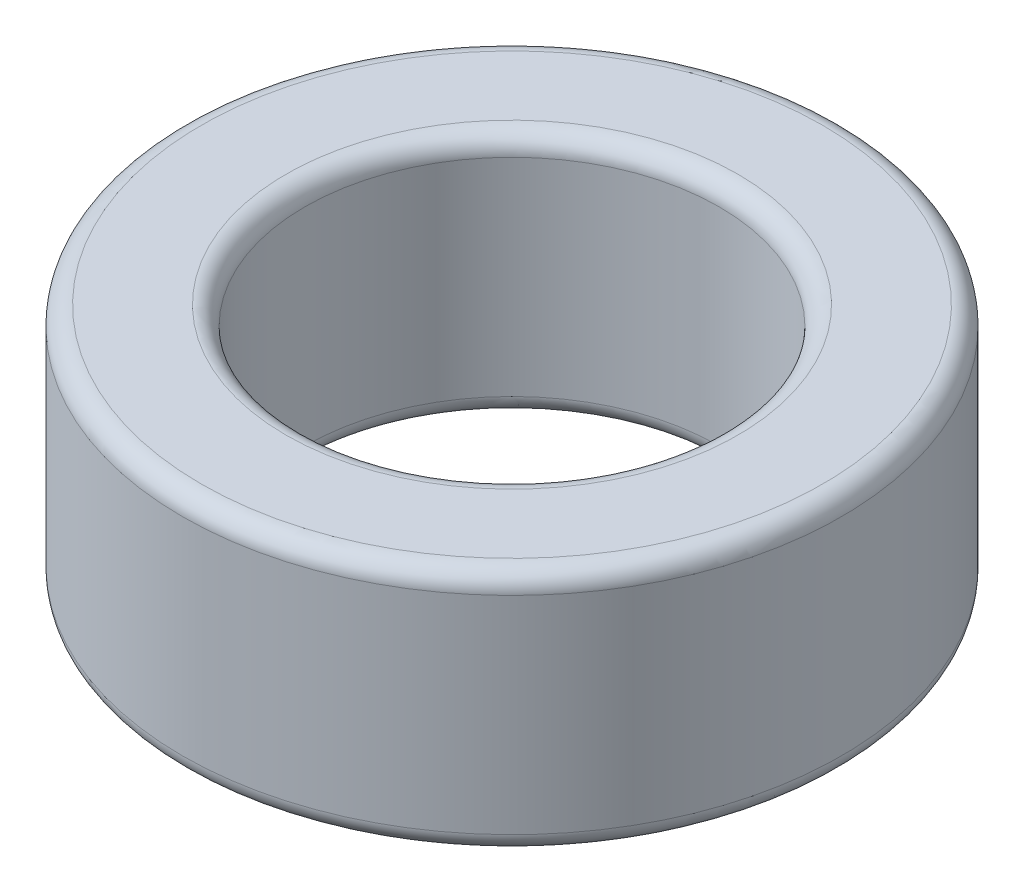
from build123d import *

# Parameters (mm, degrees)
SKETCH1_R           = 17.5
SKETCH1_R_2         = 11
BOSS_EXTRUDE1_DEPTH = 13
FILLET1_R           = 1


with BuildPart() as part:
    # Sketch1 → Boss-Extrude1 (new body)
    with BuildSketch(Plane(origin=(0, 0, 0), x_dir=(1, 0, 0), z_dir=(0, 1, 0))):
        with Locations(Location((0, 0, 0), (0, 0, 90))):
            Circle(SKETCH1_R)
        with Locations(Location((0, 0, 0), (0, 0, 90))):
            Circle(SKETCH1_R_2, mode=Mode.SUBTRACT)
    extrude(amount=BOSS_EXTRUDE1_DEPTH)

    # Fillet1
    fillet1_edges = [part.edges().sort_by_distance(p)[0] for p in [
        (0, 0, 17.5),
        (0, 13, 17.5),
        (0, 0, 11),
        (0, 13, 11),
    ]]
    fillet(fillet1_edges, radius=FILLET1_R)


solid = part.part
